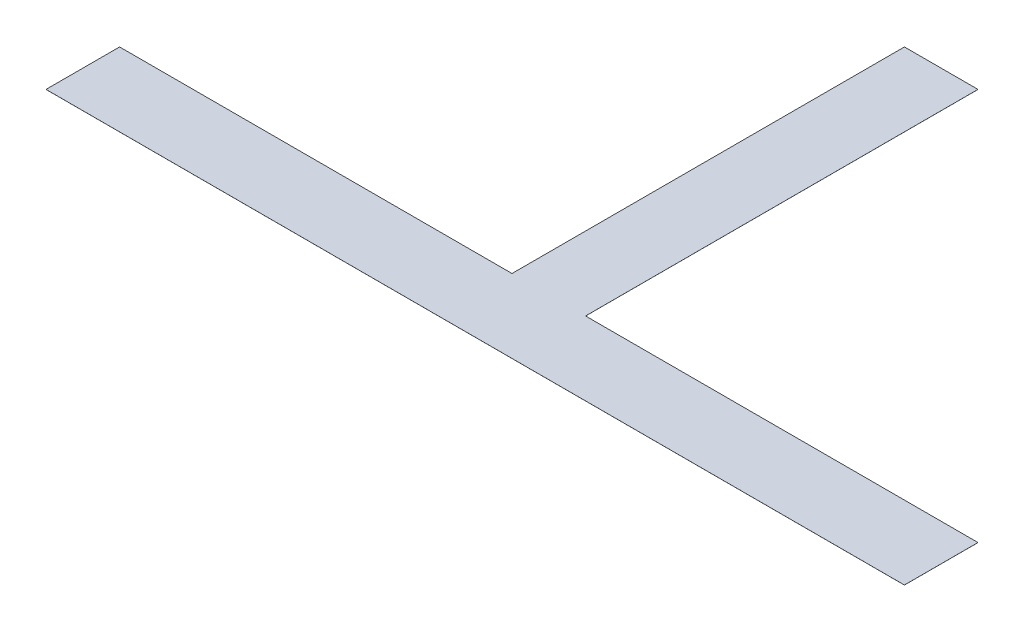
from build123d import *

# Parameters (mm, degrees)
BOSS_EXTRUDE3_DEPTH = 0.02


with BuildPart() as part:
    # Sketch3 → Boss-Extrude3 (new body)
    with BuildSketch(Plane(origin=(0, 0, 0), x_dir=(1, 0, 0), z_dir=(0, 1, 0))):
        Polygon((175, -102.5), (175, -72.5), (15, -72.5), (15, 87.5), (-15, 87.5), (-15, -72.5), (-175, -72.5), (-175, -102.5), align=None)
    extrude(amount=BOSS_EXTRUDE3_DEPTH)


solid = part.part
